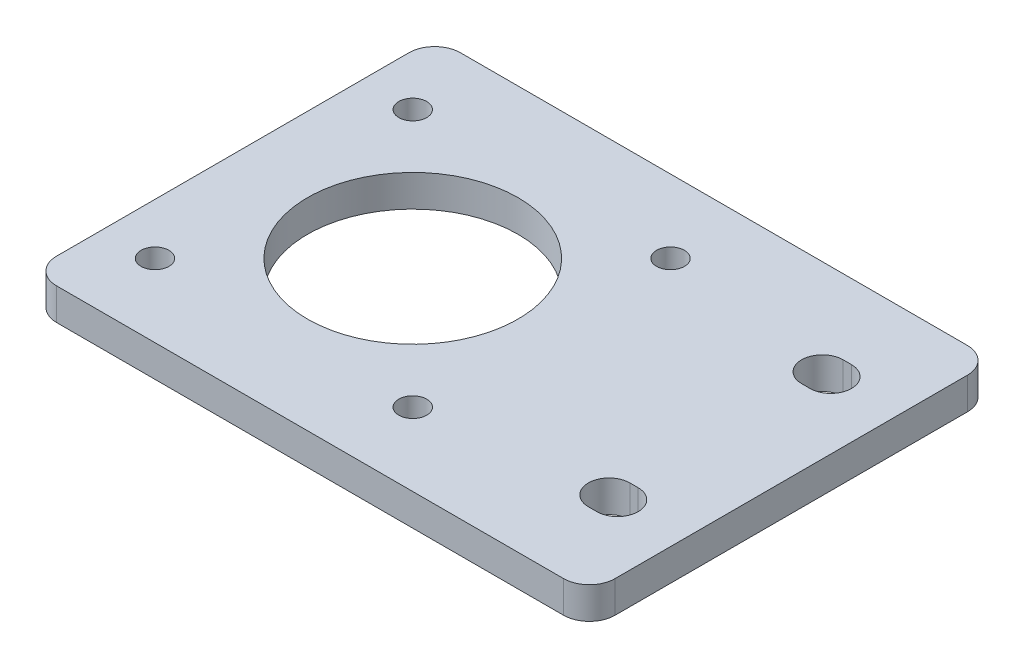
from build123d import *

# Parameters (mm, degrees)
SKETCH1_W           = 65
SKETCH1_H           = 47
SKETCH1_R           = 12.25
SKETCH1_R_2         = 1.623849847
BOSS_EXTRUDE1_DEPTH = 3.7
FILLET1_R           = 3


with BuildPart() as part:
    # Sketch1 → Boss-Extrude1 (new body)
    with BuildSketch(Plane(origin=(0, 0, 0), x_dir=(1, 0, 0), z_dir=(0, 1, 0))):
        with Locations((15.646990036, 10.777629745)):
            Rectangle(SKETCH1_W, SKETCH1_H)
        with Locations(Location((4.096990036, 10.777629745, 0), (0, 0, 270))):
            Circle(SKETCH1_R, mode=Mode.SUBTRACT)
        with Locations(Location((-10.903009964, -4.222370255, 0), (0, 0, 270))):
            Circle(SKETCH1_R_2, mode=Mode.SUBTRACT)
        with Locations(Location((19.096990036, -4.222370255, 0), (0, 0, 270))):
            Circle(SKETCH1_R_2, mode=Mode.SUBTRACT)
        with Locations(Location((19.096990036, 25.777629745, 0), (0, 0, 270))):
            Circle(SKETCH1_R_2, mode=Mode.SUBTRACT)
        with Locations(Location((-10.903009964, 25.777629745, 0), (0, 0, 270))):
            Circle(SKETCH1_R_2, mode=Mode.SUBTRACT)
        with BuildLine():
            Line((39.356990036, 0.777629745), (40.336990036, 0.777629745))
            ThreePointArc((40.336990036, 0.777629745), (42.746990036, -1.632370255), (40.336990036, -4.042370255))
            Line((40.336990036, -4.042370255), (39.356990036, -4.042370255))
            ThreePointArc((39.356990036, -4.042370255), (36.946990036, -1.632370255), (39.356990036, 0.777629745))
        make_face(mode=Mode.SUBTRACT)
        with BuildLine():
            Line((39.356990036, 20.777629745), (40.336990036, 20.777629745))
            ThreePointArc((40.336990036, 20.777629745), (42.746990036, 23.187629745), (40.336990036, 25.597629745))
            Line((40.336990036, 25.597629745), (39.356990036, 25.597629745))
            ThreePointArc((39.356990036, 25.597629745), (36.946990036, 23.187629745), (39.356990036, 20.777629745))
        make_face(mode=Mode.SUBTRACT)
    extrude(amount=BOSS_EXTRUDE1_DEPTH)

    # Fillet1
    fillet1_edges = [part.edges().sort_by_distance(p)[0] for p in [
        (-16.853009964, 1.85, -34.277629745),
        (48.146990036, 1.85, -34.277629745),
        (48.146990036, 1.85, 12.722370255),
        (-16.853009964, 1.85, 12.722370255),
    ]]
    fillet(fillet1_edges, radius=FILLET1_R)


solid = part.part
